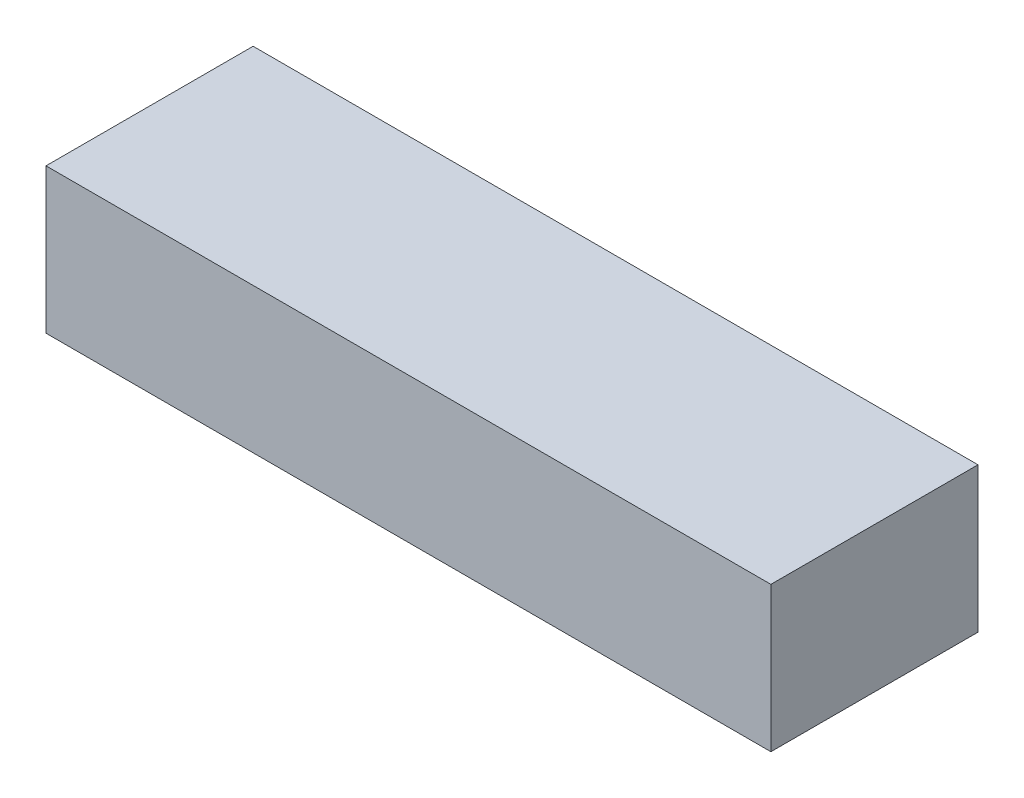
from build123d import *

# Parameters (mm, degrees)
SKETCH_1_W      = 17.5
SKETCH_1_H      = 5
EXTRUDE_1_DEPTH = 3.5


with BuildPart() as part:
    # 草图1 → 凸台-拉伸1 (new body)
    with BuildSketch(Plane(origin=(0, 0, 0), x_dir=(1, 0, 0), z_dir=(0, 1, 0))):
        Rectangle(SKETCH_1_W, SKETCH_1_H)
    extrude(amount=EXTRUDE_1_DEPTH)


solid = part.part
